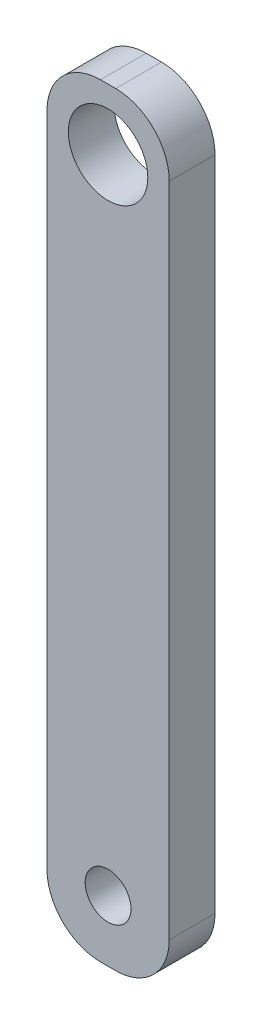
from build123d import *

# Parameters (mm, degrees)
SKETCH1_W           = 50
SKETCH1_H           = 8
SKETCH1_R           = 1.5
SKETCH1_R_2         = 2.6
BOSS_EXTRUDE1_DEPTH = 3
FILLET1_R           = 3.5
SCALE1_SCALE        = 0.7


with BuildPart() as part:
    # Sketch1 → Boss-Extrude1 (new body)
    with BuildSketch(Plane(origin=(0, 0, 0), x_dir=(0, 1, 0), z_dir=(0, 0, 1))):
        Rectangle(SKETCH1_W, SKETCH1_H)
        with Locations(Location((-21, 0, 0), (0, 0, 270))):
            Circle(SKETCH1_R, mode=Mode.SUBTRACT)
        with Locations(Location((21, 0, 0), (0, 0, 270))):
            Circle(SKETCH1_R_2, mode=Mode.SUBTRACT)
    extrude(amount=-BOSS_EXTRUDE1_DEPTH)

    # Fillet1
    fillet1_edges = [part.edges().sort_by_distance(p)[0] for p in [
        (4, 25, -1.5),
        (4, -25, -1.5),
        (-4, -25, -1.5),
        (-4, 25, -1.5),
    ]]
    fillet(fillet1_edges, radius=FILLET1_R)


with BuildPart() as part_1:
    # Scale1: scaled about (0, -0.82380326, -1.5)
    add(part.part.scale(SCALE1_SCALE).moved(Location((0, -0.247140978, -0.45))))


solid = part_1.part
